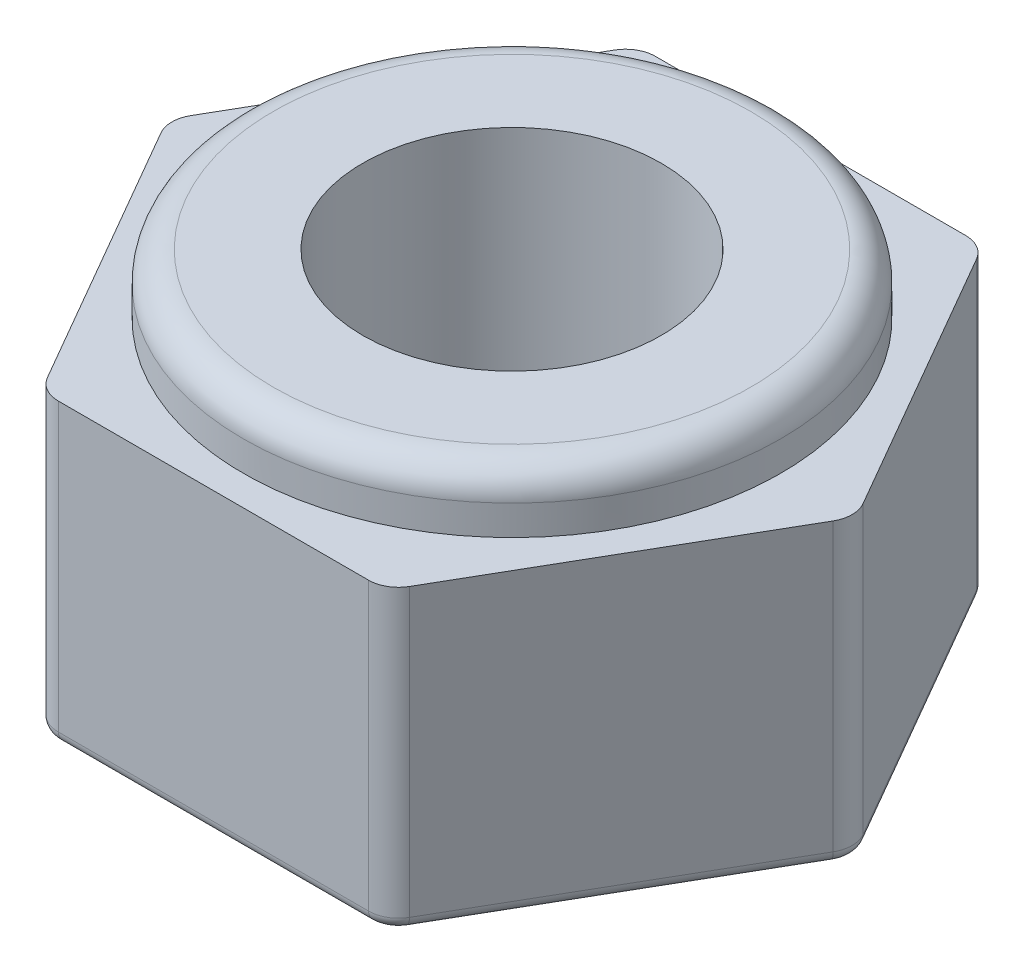
from build123d import *

# Parameters (mm, degrees)
CROQUIS1_R              = 2.5
SALIENTE_EXTRUIR1_DEPTH = 6
REDONDEO1_R             = 0.5
REDONDEO2_R             = 0.2
CROQUIS3_W              = 2.5
CROQUIS3_H              = 1
REDONDEO3_R             = 0.5


with BuildPart() as part:
    # Croquis1 → Saliente-Extruir1 (new body)
    with BuildSketch(Plane(origin=(0, 0, 0), x_dir=(1, 0, 0), z_dir=(0, 1, 0))):
        Polygon((-2.886751346, 5), (-5.773502692, 0), (-2.886751346, -5), (2.886751346, -5), (5.773502692, 0), (2.886751346, 5), align=None)
        with Locations(Location((0, 0, 0), (0, 0, 270))):
            Circle(CROQUIS1_R, mode=Mode.SUBTRACT)
    extrude(amount=SALIENTE_EXTRUIR1_DEPTH)

    # Redondeo1
    redondeo1_edges = [part.edges().sort_by_distance(p)[0] for p in [
        (2.886751346, 3, -5),
        (5.773502692, 3, 0),
        (2.886751346, 3, 5),
        (-2.886751346, 3, 5),
        (-5.773502692, 3, 0),
        (-2.886751346, 3, -5),
    ]]
    fillet(redondeo1_edges, radius=REDONDEO1_R)

    # Redondeo2
    redondeo2_edges = [part.edges().sort_by_distance(p)[0] for p in [
        (-4.330127019, 0, -2.5),
        (-4.330127019, 6, -2.5),
        (0, 0, -5),
        (4.330127019, 0, -2.5),
        (4.330127019, 0, 2.5),
        (0, 0, 5),
        (-4.330127019, 0, 2.5),
        (-2.848076211, 0, 4.933012702),
        (-5.696152423, 0, 0),
        (2.848076211, 0, 4.933012702),
        (5.696152423, 0, 0),
        (2.848076211, 0, -4.933012702),
        (-2.848076211, 0, -4.933012702),
        (0, 6, -5),
        (-4.330127019, 6, 2.5),
        (0, 6, 5),
        (4.330127019, 6, 2.5),
        (4.330127019, 6, -2.5),
        (-2.848076211, 6, 4.933012702),
        (-5.696152423, 6, 0),
        (2.848076211, 6, 4.933012702),
        (5.696152423, 6, 0),
        (2.848076211, 6, -4.933012702),
        (-2.848076211, 6, -4.933012702),
    ]]
    fillet(redondeo2_edges, radius=REDONDEO2_R)

    # Croquis3 → Cortar-Revolución1 (revolve, cut)
    with BuildSketch(Plane.XY, mode=Mode.PRIVATE) as cortar_revoluci_n1_sk:
        with Locations((-5.75, 5.5)):
            Rectangle(CROQUIS3_W, CROQUIS3_H)
    revolve(cortar_revoluci_n1_sk.sketch.rotate(Axis((0, 0, 0), (0, 1, 0)), 270), axis=Axis((0, 0, 0), (0, 1, 0)), mode=Mode.SUBTRACT)

    # Redondeo3
    redondeo3_edges = [part.edges().sort_by_distance(p)[0] for p in [
        (0, 6, 4.5),
    ]]
    fillet(redondeo3_edges, radius=REDONDEO3_R)


solid = part.part
